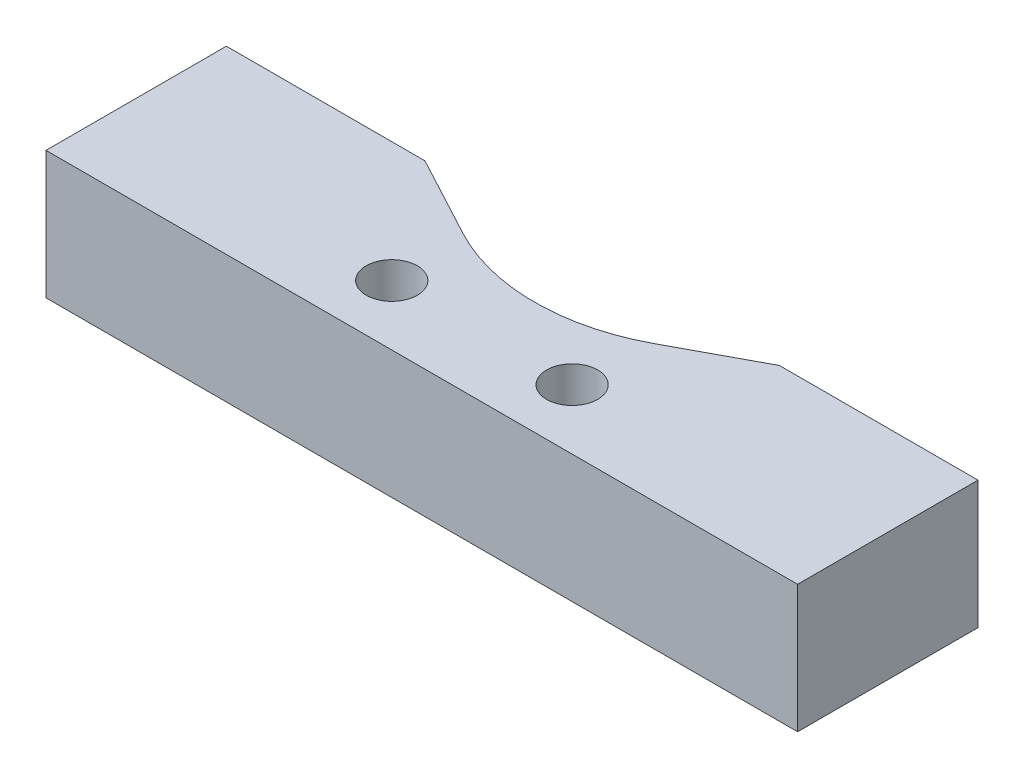
from build123d import *

# Parameters (mm, degrees)
EXTRUDE_1_DEPTH     = 8.5
SKETCH_2_R          = 1.7
CUT_EXTRUDE_1_DEPTH = 34.737960816


with BuildPart() as part:
    # 草图1 → 凸台-拉伸1 (new body)
    with BuildSketch(Plane(origin=(0, 0, 0), x_dir=(1, 0, 0), z_dir=(0, 1, 0))):
        with BuildLine():
            Line((-25, -21), (25, -21))
            Line((25, -21), (25, -9))
            Line((25, -9), (11.788272368, -9))
            Line((11.788272368, -9), (6.375, -11.899973739))
            ThreePointArc((6.375, -11.899973739), (0, -13.5), (-6.375, -11.899973739))
            Line((-6.375, -11.899973739), (-11.788272368, -9))
            Line((-11.788272368, -9), (-25, -9))
            Line((-25, -9), (-25, -21))
        make_face()
    extrude(amount=EXTRUDE_1_DEPTH)

    # 草图2 → 切除-拉伸1 (cut, through all)
    with BuildSketch(Plane(origin=(0, 8.5, 0), x_dir=(1, 0, 0), z_dir=(0, 1, 0))):
        with Locations(Location((6, -17, 0), (0, 0, 270))):
            Circle(SKETCH_2_R)
        with Locations(Location((-6, -17, 0), (0, 0, 90))):
            Circle(SKETCH_2_R)
    extrude(amount=-CUT_EXTRUDE_1_DEPTH, mode=Mode.SUBTRACT)


solid = part.part
